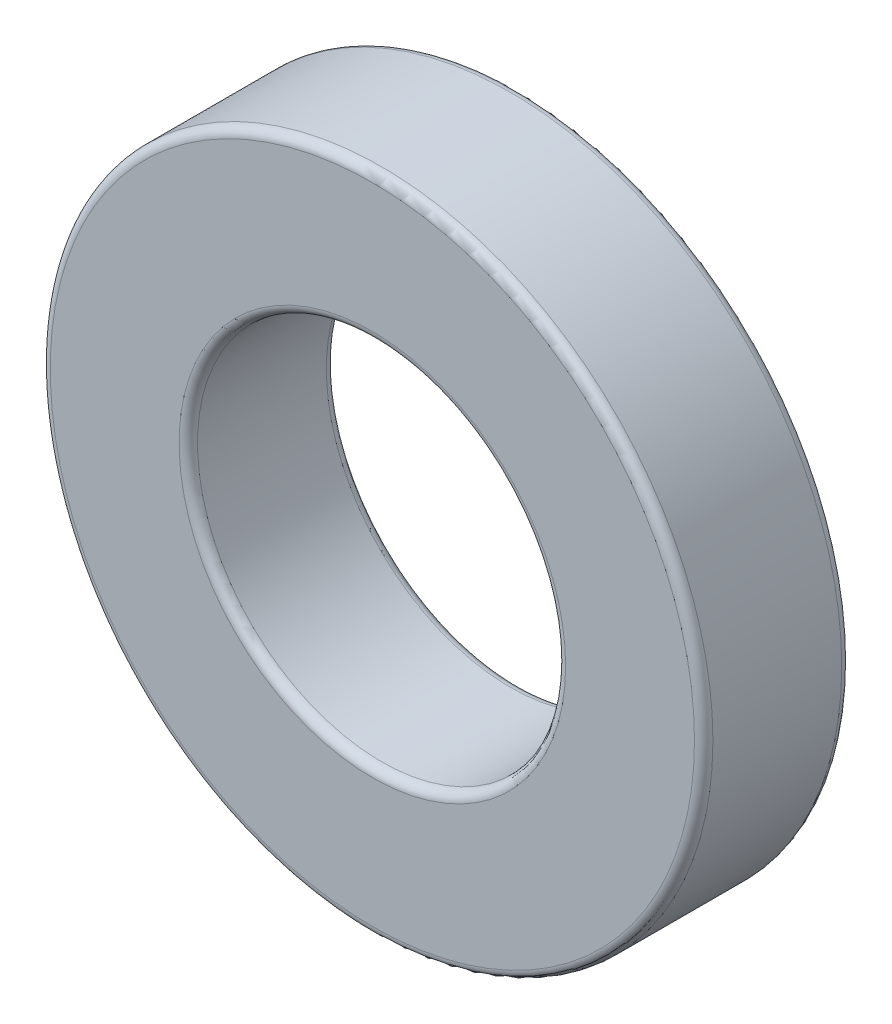
from build123d import *

# Parameters (mm, degrees)
SKETCH_1_R          = 18
EXTRUDE_1_DEPTH     = 8
SKETCH_2_R          = 10
CUT_EXTRUDE_1_DEPTH = 27.683328128
FILLET_1_R          = 0.5


with BuildPart() as part:
    # 草图1 → 凸台-拉伸1 (new body)
    with BuildSketch(Plane.XY):
        Circle(SKETCH_1_R)
    extrude(amount=EXTRUDE_1_DEPTH)

    # 草图2 → 切除-拉伸1 (cut, through all)
    with BuildSketch(Plane.XY.offset(8)):
        Circle(SKETCH_2_R)
    extrude(amount=-CUT_EXTRUDE_1_DEPTH, mode=Mode.SUBTRACT)

    # 圆角1
    fillet_1_edges = [part.edges().sort_by_distance(p)[0] for p in [
        (-18, 0, 0),
        (-18, 0, 8),
        (-10, 0, 0),
        (-10, 0, 8),
    ]]
    fillet(fillet_1_edges, radius=FILLET_1_R)


solid = part.part
